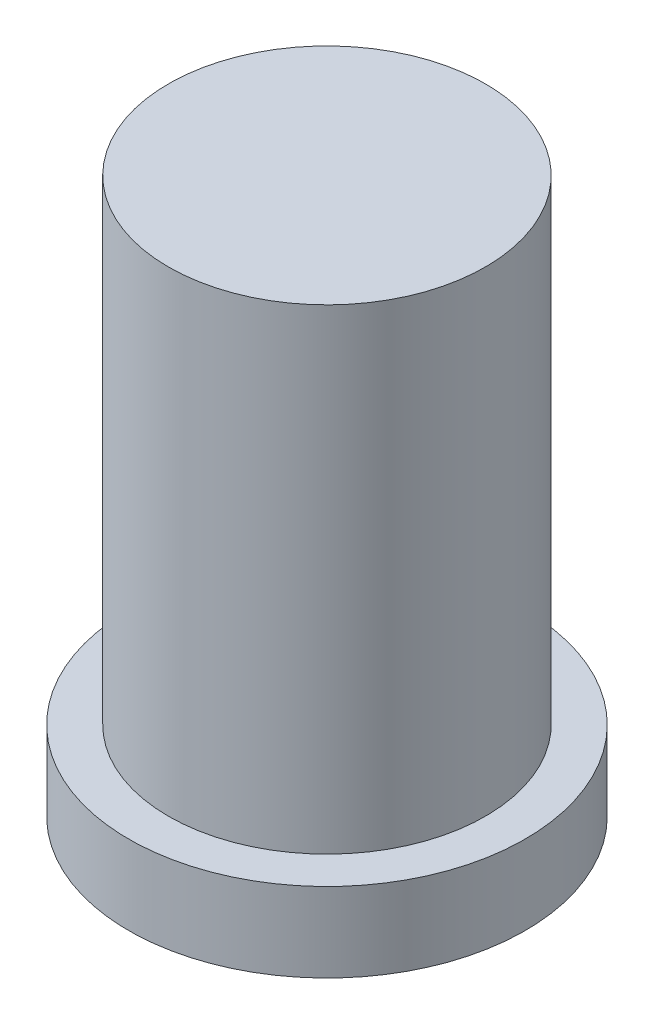
from build123d import *

# Parameters (mm, degrees)
SKETCH1_R           = 4
BOSS_EXTRUDE1_DEPTH = 12
SKETCH2_R           = 5
BOSS_EXTRUDE2_DEPTH = 2


with BuildPart() as part:
    # Sketch1 → Boss-Extrude1 (new body)
    with BuildSketch(Plane(origin=(0, 0, 0), x_dir=(1, 0, 0), z_dir=(0, 1, 0))):
        with Locations(Location((0, 0, 0), (0, 0, 270))):
            Circle(SKETCH1_R)
    extrude(amount=BOSS_EXTRUDE1_DEPTH)

    # Sketch2 → Boss-Extrude2 (add)
    with BuildSketch(Plane(origin=(0, 0, 0), x_dir=(-1, 0, 0), z_dir=(0, -1, 0))):
        with Locations(Location((0, 0, 0), (0, 0, 90))):
            Circle(SKETCH2_R)
    extrude(amount=BOSS_EXTRUDE2_DEPTH)


solid = part.part
